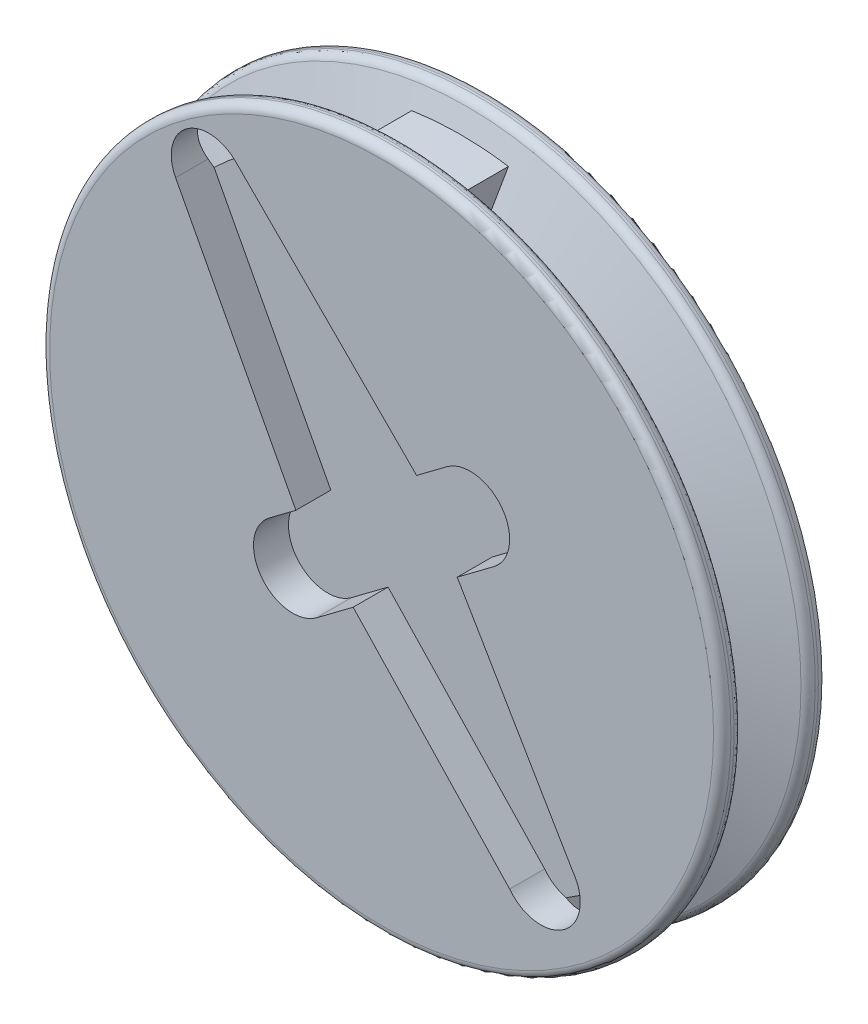
from build123d import *

# Parameters (mm, degrees)
SKETCH1_R           = 5.75
BOSS_EXTRUDE1_DEPTH = 1.825
SKETCH2_R           = 19.5
BOSS_EXTRUDE2_DEPTH = 6
CUT_EXTRUDE2_DEPTH  = 2
CUT_EXTRUDE3_REACH  = 60.396
FILLET2_R           = 0.5
SKETCH11_W          = 3
SKETCH11_H          = 2


with BuildPart() as part:
    # Sketch1 → Boss-Extrude1 (new body)
    with BuildSketch(Plane.XY):
        with Locations((-8.400000005, 31.200000007)):
            Circle(SKETCH1_R)
    extrude(amount=-BOSS_EXTRUDE1_DEPTH)

    # Sketch2 → Boss-Extrude2 (add)
    with BuildSketch(Plane.XY):
        with Locations((-8.400000005, 31.200000007)):
            Circle(SKETCH2_R)
    extrude(amount=BOSS_EXTRUDE2_DEPTH)

    # Sketch5 → Cut-Extrude2 (cut)
    with BuildSketch(Plane.XY.offset(6)):
        with BuildLine():
            Line((-19.325534026, 42.017410383), (-12.29612336, 31.09040749))
            Line((-12.29612336, 31.09040749), (-14.830000005, 29.190000007))
            ThreePointArc((-14.830000005, 29.190000007), (-15.280000005, 26.040000007), (-12.130000005, 25.590000007))
            Line((-12.130000005, 25.590000007), (-10.028559912, 27.166080076))
            Line((-10.028559912, 27.166080076), (-1.07121762, 17.678368832))
            ThreePointArc((-1.07121762, 17.678368832), (2.069999995, 17.240000007), (2.528706855, 20.378312188))
            Line((2.528706855, 20.378312188), (-4.071440097, 31.633919937))
            Line((-4.071440097, 31.633919937), (-1.970000005, 33.210000007))
            ThreePointArc((-1.970000005, 33.210000007), (-1.520000005, 36.360000007), (-4.670000005, 36.810000007))
            Line((-4.670000005, 36.810000007), (-7.203876649, 34.909592523))
            Line((-7.203876649, 34.909592523), (-15.72556444, 44.717387572))
            ThreePointArc((-15.72556444, 44.717387572), (-18.870000005, 45.160000007), (-19.325534026, 42.017410383))
        make_face()
    extrude(amount=-CUT_EXTRUDE2_DEPTH, mode=Mode.SUBTRACT)

    # Sketch6 → Cut-Revolve2 (revolve, cut)
    with BuildSketch(Plane(origin=(-8.400000005, 0, 0), x_dir=(0, 0, -1), z_dir=(1, 0, 0)), mode=Mode.PRIVATE) as cut_revolve2_sk:
        Polygon((-5, 50.700000007), (-3, 44.700000007), (-1, 50.700000007), align=None)
    revolve(cut_revolve2_sk.sketch.rotate(Axis((-8.400000005, 31.09040749, 6), (0, 0, -1)), 234.721275033), axis=Axis((-8.400000005, 31.09040749, 6), (0, 0, -1)), mode=Mode.SUBTRACT)

    # Cut-Extrude3: up to this face of the body (flat: up to its plane)
    cut_extrude3_end = Plane(part.part.faces().sort_by_distance((-8.253598799, 31.004565822, 4))[0])
    # Sketch10 → Cut-Extrude3 (cut, up to the picked face)
    with BuildSketch(Plane.XY.offset(6), mode=Mode.PRIVATE) as cut_extrude3_sk1:
        with BuildLine():
            Line((-6.394829661, 35.516377765), (-16.763362693, 45.903970239))
            ThreePointArc((-16.763362693, 45.903970239), (-19.564512142, 46.116263602), (-20.191514703, 43.377947606))
            Line((-20.191514703, 43.377947606), (-13.306996168, 30.332252884))
            Line((-13.306996168, 30.332252884), (-6.394829661, 35.516377765))
        make_face()
    cut_extrude3_tool1 = split(extrude(cut_extrude3_sk1.sketch, amount=-CUT_EXTRUDE3_REACH, mode=Mode.PRIVATE), bisect_by=cut_extrude3_end, keep=Keep.BOTH, mode=Mode.PRIVATE)
    add(cut_extrude3_tool1.solids().sort_by(Axis((-13.988483, 38.541147, 6), (0, 0, -1)))[0], mode=Mode.SUBTRACT)

    # Fillet2
    fillet2_edges = [part.edges().sort_by_distance(p)[0] for p in [
        (2.710219474, 38.950689393, 3),
        (-14.351603991, 49.769556005, 4.99826644),
        (-14.351603992, 49.769556005, 1.00173356),
        (-27.900000005, 31.200000007, 0),
        (-27.900000005, 31.200000007, 6),
    ]]
    fillet(fillet2_edges, radius=FILLET2_R)

    # Sweep1: sweep along a path in Sketch13
    with BuildLine(Plane.XY) as sweep1_path:
        ThreePointArc((-11.400000005, 50.467848875), (-8.400000005, 50.700000007), (-5.400000005, 50.467848875))
    # Sketch11 → Sweep1 (sweep)
    with BuildSketch(Plane(origin=(-8.400000005, 0, 0), x_dir=(0, 0, -1), z_dir=(1, 0, 0))):
        with Locations((-3, 48.182111944)):
            Rectangle(SKETCH11_W, SKETCH11_H)
    sweep(path=sweep1_path.line)


solid = part.part
